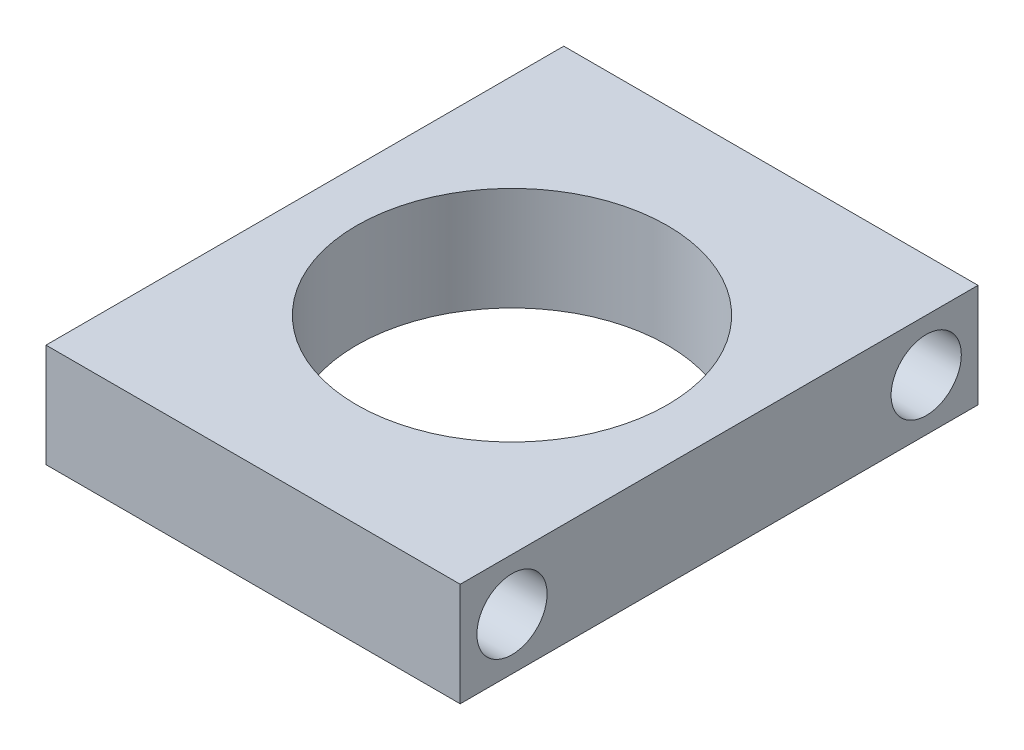
from build123d import *

# Parameters (mm, degrees)
SKETCH1_W           = 25.4
SKETCH1_H           = 31.75
BOSS_EXTRUDE1_DEPTH = 3.175
SKETCH3_R           = 2.15265
CUT_EXTRUDE1_DEPTH  = 31.120694713
SKETCH4_R           = 9.525
CUT_EXTRUDE2_DEPTH  = 31.618591166


with BuildPart() as part:
    # Sketch1 → Boss-Extrude1 (new, symmetric)
    with BuildSketch(Plane(origin=(0, 0, 0), x_dir=(1, 0, 0), z_dir=(0, 1, 0))):
        with Locations((-12.7, 0)):
            Rectangle(SKETCH1_W, SKETCH1_H)
    extrude(amount=BOSS_EXTRUDE1_DEPTH, both=True)

    # Sketch3 → Cut-Extrude1 (cut, through all)
    with BuildSketch(Plane(origin=(0, 0, 0), x_dir=(0, 0, -1), z_dir=(1, 0, 0))):
        with Locations((-12.7, 0)):
            Circle(SKETCH3_R)
        with Locations((12.7, 0)):
            Circle(SKETCH3_R)
    extrude(amount=-CUT_EXTRUDE1_DEPTH, mode=Mode.SUBTRACT)

    # Sketch4 → Cut-Extrude2 (cut, through all)
    with BuildSketch(Plane(origin=(0, 3.175, 0), x_dir=(1, 0, 0), z_dir=(0, 1, 0))):
        with Locations(Location((-12.7, 0, 0), (0, 0, 270))):
            Circle(SKETCH4_R)
    extrude(amount=-CUT_EXTRUDE2_DEPTH, mode=Mode.SUBTRACT)


solid = part.part
